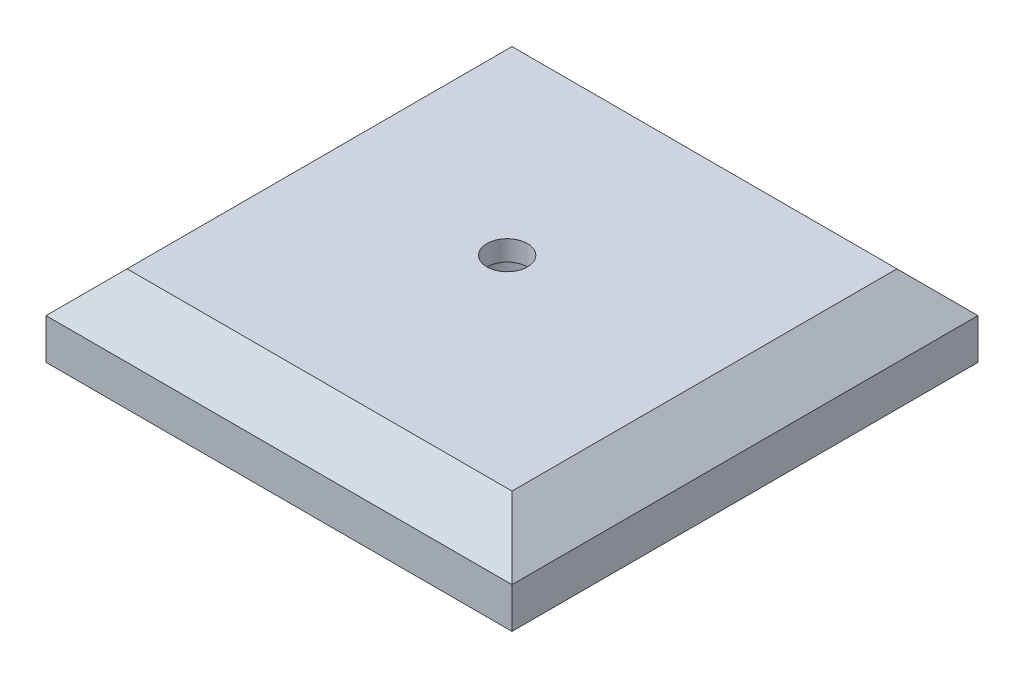
from build123d import *

# Parameters (mm, degrees)
SKETCH1_W           = 2875
SKETCH1_H           = 2875
BOSS_EXTRUDE1_DEPTH = 500
CHAMFER1_SIZE       = 250


with BuildPart() as part:
    # Sketch1 → Boss-Extrude1 (new body)
    with BuildSketch(Plane(origin=(0, 0, 0), x_dir=(1, 0, 0), z_dir=(0, 1, 0))):
        with Locations((-1437.5, -1437.5)):
            Rectangle(SKETCH1_W, SKETCH1_H)
    extrude(amount=BOSS_EXTRUDE1_DEPTH)

    # Chamfer1
    chamfer1_edges = [part.edges().sort_by_distance(p)[0] for p in [
        (-1437.5, 500, 0),
        (0, 500, 1437.5),
        (-1437.5, 500, 2875),
        (-2875, 500, 1437.5),
    ]]
    chamfer(chamfer1_edges, length=CHAMFER1_SIZE)

    # Sketch6 → Hole2 (revolve, cut)
    with BuildSketch(Plane(origin=(-1524.955171355, 500, 1379.812775197), x_dir=(0, 0, 1), z_dir=(1, 0, 0))):
        Polygon((0, 0), (0, 500), (250, 500), (250, 125), (125, 125), (125, 0), align=None)
    revolve(axis=Axis((-1524.955171355, 506.35, 1379.812775197), (0, -1, 0)), mode=Mode.SUBTRACT)


solid = part.part
